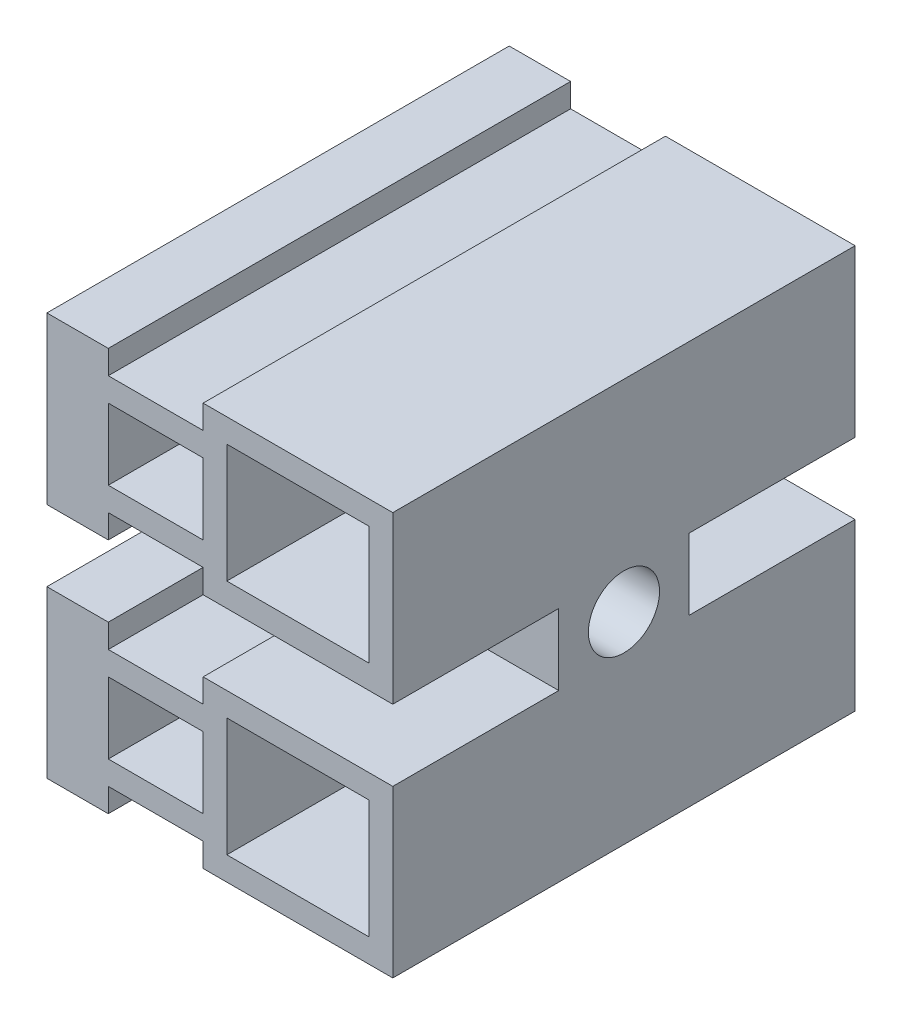
from build123d import *

# Parameters (mm, degrees)
CROQUIS2_W              = 6
CROQUIS2_H              = 5
SALIENTE_EXTRUIR1_DEPTH = 19.5
CORTAR_EXTRUIR1_REACH   = 29.079
CROQUIS4_R              = 1.5
CROQUIS4_W              = 7
CROQUIS4_H              = 3


with BuildPart() as part:
    # Croquis2 → Saliente-Extruir1 (new body)
    # profile 1 of 2: a face of its own
    with BuildSketch(Plane.XY):
        Polygon((0, -7), (0, 0), (-8, 0), (-8, -1), (-12, -1), (-12, 0), (-14.589269471, 0), (-14.589269471, -7), (-12, -7), (-12, -6), (-8, -6), (-8, -7), (-8, -8.5), (0, -8.5), align=None)
        Polygon((-8, -2), (-8, -3.5), (-8, -5), (-12, -5), (-12, -2), align=None, mode=Mode.SUBTRACT)
        with Locations((-4, -3.5)):
            Rectangle(CROQUIS2_W, CROQUIS2_H, mode=Mode.SUBTRACT)
    # profile 2 of 2: a face of its own
    with BuildSketch(Plane.XY):
        Polygon((0, -10), (0, -8.5), (-8, -8.5), (-8, -10), (-8, -11), (-12, -11), (-12, -10), (-14.589269471, -10), (-14.589269471, -17), (-12, -17), (-12, -16), (-8, -16), (-8, -17), (0, -17), align=None)
        Polygon((-12, -12), (-8, -12), (-8, -13.5), (-8, -15), (-12, -15), align=None, mode=Mode.SUBTRACT)
        with Locations((-4, -13.5)):
            Rectangle(CROQUIS2_W, CROQUIS2_H, mode=Mode.SUBTRACT)
    extrude(amount=SALIENTE_EXTRUIR1_DEPTH)

    # Croquis4 → Cortar-Extruir1 (cut, up to next)
    with BuildSketch(Plane.ZY.offset(8), mode=Mode.PRIVATE) as cortar_extruir1_sk1:
        with Locations((9.75, -8.5)):
            Circle(CROQUIS4_R)
    cortar_extruir1_tool1 = extrude(cortar_extruir1_sk1.sketch, amount=-CORTAR_EXTRUIR1_REACH, mode=Mode.PRIVATE) & part.part
    # Croquis4 → Cortar-Extruir1 (cut, up to next)
    with BuildSketch(Plane.ZY.offset(8), mode=Mode.PRIVATE) as cortar_extruir1_sk2:
        with Locations((3.5, -8.5)):
            Rectangle(CROQUIS4_W, CROQUIS4_H)
    cortar_extruir1_tool2 = extrude(cortar_extruir1_sk2.sketch, amount=-CORTAR_EXTRUIR1_REACH, mode=Mode.PRIVATE) & part.part
    # Croquis4 → Cortar-Extruir1 (cut, up to next)
    with BuildSketch(Plane.ZY.offset(8), mode=Mode.PRIVATE) as cortar_extruir1_sk3:
        with Locations((16, -8.5)):
            Rectangle(CROQUIS4_W, CROQUIS4_H)
    cortar_extruir1_tool3 = extrude(cortar_extruir1_sk3.sketch, amount=-CORTAR_EXTRUIR1_REACH, mode=Mode.PRIVATE) & part.part
    add(cortar_extruir1_tool1.solids().sort_by_distance((-8, -8.5, 9.75))[0], mode=Mode.SUBTRACT)
    add(cortar_extruir1_tool2.solids().sort_by_distance((-8, -8.5, 3.5))[0], mode=Mode.SUBTRACT)
    add(cortar_extruir1_tool3.solids().sort_by_distance((-8, -8.5, 16))[0], mode=Mode.SUBTRACT)


solid = part.part
